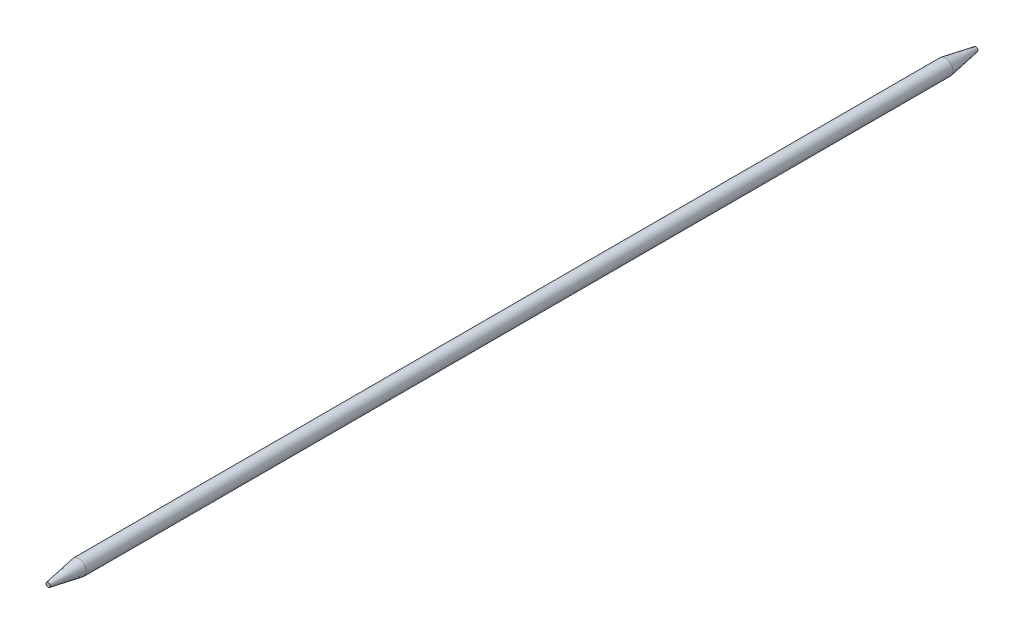
from build123d import *

# Parameters (mm, degrees)
SKETCH1_R           = 88.9
BOSS_EXTRUDE1_DEPTH = 10972.8
CHAMFER1_SIZE       = 63.5
CHAMFER1_SIZE2      = 360.126395546
CHAMFER2_SIZE       = 63.5
CHAMFER2_SIZE2      = 360.126395546


with BuildPart() as part:
    # Sketch1 → Boss-Extrude1 (new body)
    with BuildSketch(Plane.XY):
        Circle(SKETCH1_R)
    extrude(amount=BOSS_EXTRUDE1_DEPTH)

    # Chamfer1
    chamfer1_edges = [part.edges().sort_by_distance(p)[0] for p in [
        (-88.9, 0, 0),
    ]]
    chamfer1_side = [part.faces().sort_by_distance(p)[0] for p in [
        (0, 0, 0),
    ]]
    chamfer(chamfer1_edges, length=CHAMFER1_SIZE, length2=CHAMFER1_SIZE2, reference=chamfer1_side[0])

    # Chamfer2
    chamfer2_edges = [part.edges().sort_by_distance(p)[0] for p in [
        (-88.9, 0, 10972.8),
    ]]
    chamfer2_side = [part.faces().sort_by_distance(p)[0] for p in [
        (0, 0, 10972.8),
    ]]
    chamfer(chamfer2_edges, length=CHAMFER2_SIZE, length2=CHAMFER2_SIZE2, reference=chamfer2_side[0])


solid = part.part
